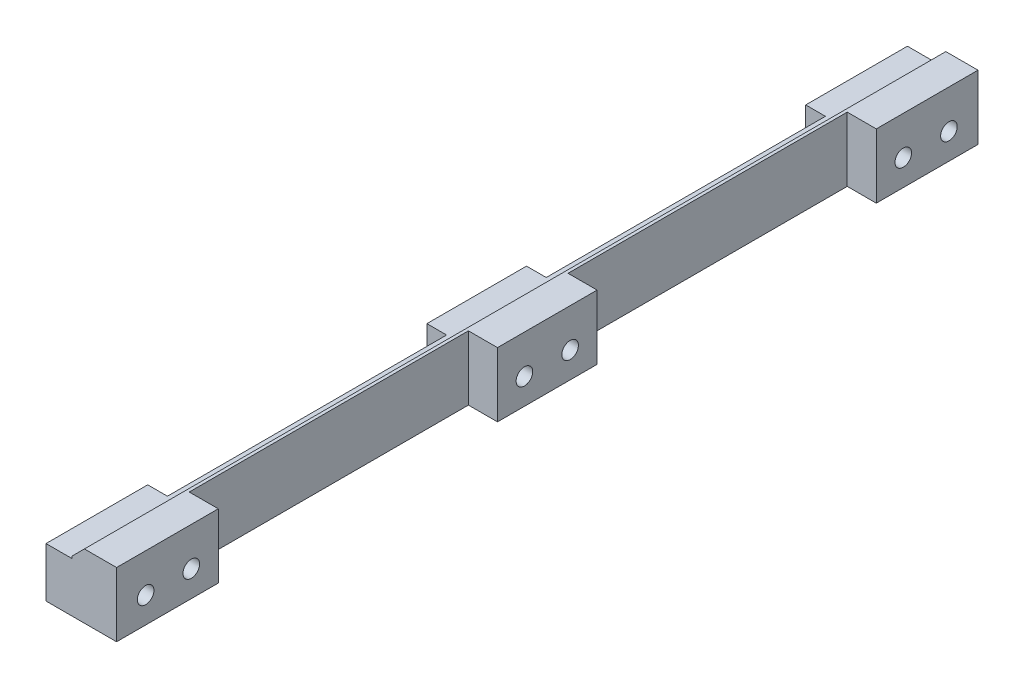
from build123d import *

# Parameters (mm, degrees)
BOSS_EXTRUDE1_DEPTH         = 9.8
BOSS_EXTRUDE2_DEPTH         = 26.9
BOSS_EXTRUDE3_DEPTH         = 9.6
BOSS_EXTRUDE4_DEPTH         = 26.9
BOSS_EXTRUDE5_DEPTH         = 9.8
TAP_DRILL_FOR_M2X0_4_TAP1_D = 1.6


with BuildPart() as part:
    # Sketch2 → Boss-Extrude1 (new body)
    with BuildSketch(Plane.XY):
        Polygon((0, 0), (6.8, 0), (6.8, 6.2), (3.7, 6.2), (2.5, 5), (2.5, 4.8), (0, 4.8), align=None)
    extrude(amount=BOSS_EXTRUDE1_DEPTH)

    # Sketch3 → Boss-Extrude2 (add)
    with BuildSketch(Plane.XY.offset(9.8)):
        Polygon((0, 0), (0, 1.6), (1.9, 1.6), (1.9, 4.8), (2.5, 4.8), (2.5, 5), (3.7, 6.2), (4, 6.2), (4, 0), align=None)
    extrude(amount=BOSS_EXTRUDE2_DEPTH)

    # Sketch6 → Boss-Extrude3 (add)
    with BuildSketch(Plane.XY.offset(36.7)):
        Polygon((0, 0), (6.8, 0), (6.8, 6.2), (3.7, 6.2), (2.5, 5), (2.5, 4.8), (0, 4.8), align=None)
    extrude(amount=BOSS_EXTRUDE3_DEPTH)

    # Sketch7 → Boss-Extrude4 (add)
    with BuildSketch(Plane.XY.offset(46.3)):
        Polygon((0, 0), (0, 1.6), (1.9, 1.6), (1.9, 4.8), (2.5, 4.8), (2.5, 5), (3.7, 6.2), (4, 6.2), (4, 0), align=None)
    extrude(amount=BOSS_EXTRUDE4_DEPTH)

    # Sketch8 → Boss-Extrude5 (add)
    with BuildSketch(Plane.XY.offset(73.2)):
        Polygon((0, 0), (6.8, 0), (6.8, 6.2), (3.7, 6.2), (2.5, 5), (2.5, 4.8), (0, 4.8), align=None)
    extrude(amount=BOSS_EXTRUDE5_DEPTH)

    # Tap Drill for M2x0.4 Tap1 (through all)
    with Locations(Plane.ZY):
        with Locations((7.2, 2.5), (2.8, 2.5), (39.3, 2.5), (43.7, 2.5), (75.8, 2.5), (80.2, 2.5)):
            Hole(TAP_DRILL_FOR_M2X0_4_TAP1_D / 2)


solid = part.part
